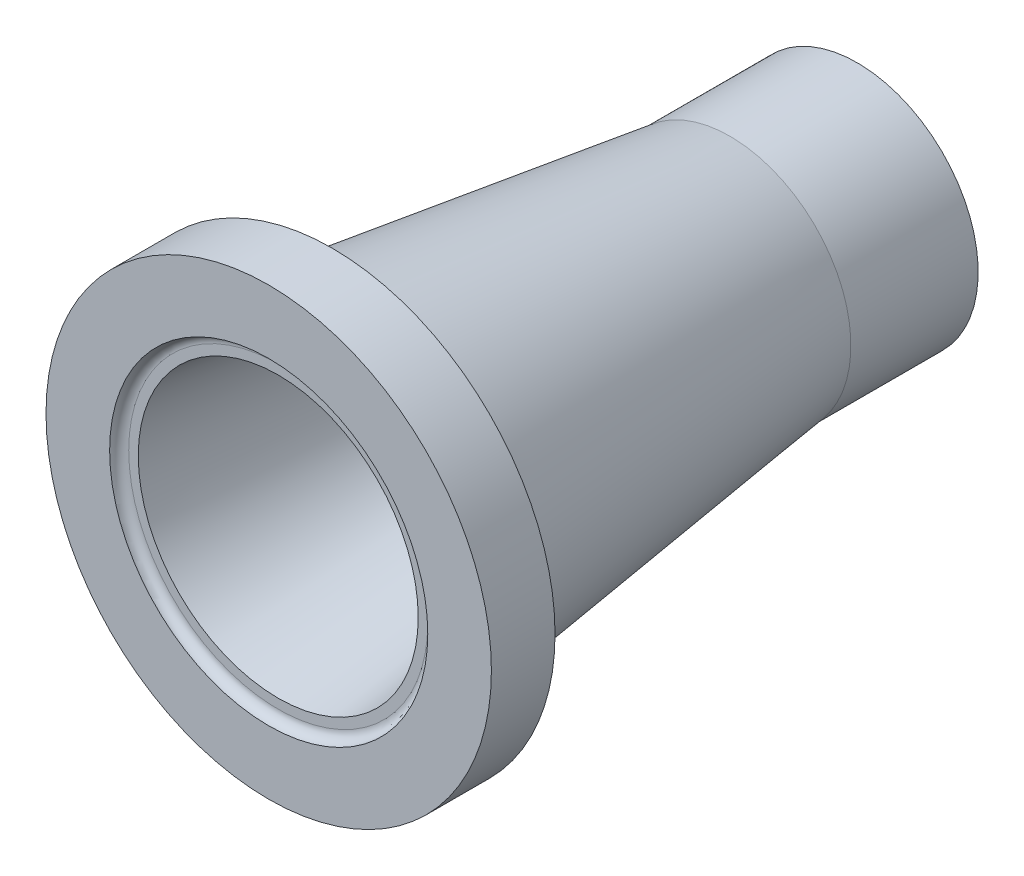
from build123d import *


with BuildPart() as part:
    # Sketch1 → Revolve1 (revolve)
    with BuildSketch(Plane(origin=(0, 0, 0), x_dir=(1, 0, 0), z_dir=(0, 1, 0)), mode=Mode.PRIVATE) as revolve1_sk:
        with BuildLine():
            Line((44, 3), (47, 3))
            ThreePointArc((47, 3), (49.121320344, 2.121320344), (50, 0))
            Line((50, 0), (70, 0))
            Line((70, 0), (70, 20))
            Line((70, 20), (56.475570251, 20))
            ThreePointArc((56.475570251, 20), (55.158468064, 20.494927966), (54.493236583, 21.734758171))
            Line((54.493236583, 21.734758171), (38, 145))
            Line((38, 145), (38, 185))
            Line((38, 185), (25, 185))
            Line((25, 185), (25, 145))
            Line((25, 145), (44, 3))
        make_face()
    revolve(revolve1_sk.sketch.rotate(Axis((0, 0, -195.705477905), (0, 0, 1)), 180), axis=Axis((0, 0, -195.705477905), (0, 0, 1)))


solid = part.part
